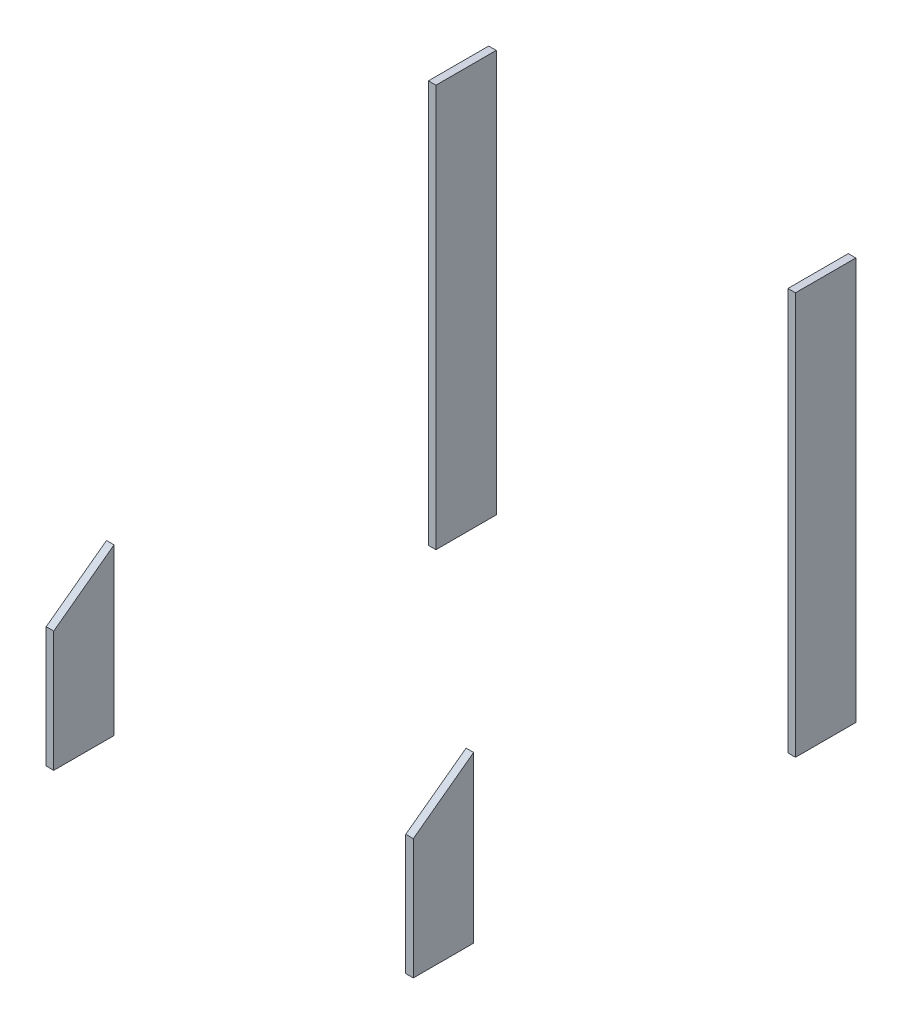
from build123d import *

# Parameters (mm, degrees)
SKETCH2_W             = 4.7625
SKETCH2_H             = 38.1
BOSS_EXTRUDE1_DEPTH   = 254
BOSS_EXTRUDE1_2_DEPTH = 254
BOSS_EXTRUDE1_3_DEPTH = 254
BOSS_EXTRUDE1_4_DEPTH = 254
CUT_EXTRUDE3_DEPTH    = 444.057570328


with BuildPart() as part:
    # Sketch2 → Boss-Extrude1 (new body)
    with BuildSketch(Plane(origin=(0, 0, 0), x_dir=(1, 0, 0), z_dir=(0, 1, 0))):
        with Locations((2.38125, -19.05)):
            Rectangle(SKETCH2_W, SKETCH2_H)
    extrude(amount=BOSS_EXTRUDE1_DEPTH)


with BuildPart() as body_2:
    # Sketch2 → Boss-Extrude1 2 (new body)
    with BuildSketch(Plane(origin=(0, 0, 0), x_dir=(1, 0, 0), z_dir=(0, 1, 0))):
        with Locations((229.39375, -19.05)):
            Rectangle(SKETCH2_W, SKETCH2_H)
    extrude(amount=BOSS_EXTRUDE1_2_DEPTH)


with BuildPart() as body_3:
    # Sketch2 → Boss-Extrude1 3 (new body)
    with BuildSketch(Plane(origin=(0, 0, 0), x_dir=(1, 0, 0), z_dir=(0, 1, 0))):
        with Locations((2.38125, -260.35)):
            Rectangle(SKETCH2_W, SKETCH2_H)
    extrude(amount=BOSS_EXTRUDE1_3_DEPTH)


with BuildPart() as body_4:
    # Sketch2 → Boss-Extrude1 4 (new body)
    with BuildSketch(Plane(origin=(0, 0, 0), x_dir=(1, 0, 0), z_dir=(0, 1, 0))):
        with Locations((229.39375, -260.35)):
            Rectangle(SKETCH2_W, SKETCH2_H)
    extrude(amount=BOSS_EXTRUDE1_4_DEPTH)


with BuildPart() as cut_extrude3_tool:
    # Sketch3 → Cut-Extrude3 (new, through all)
    with BuildSketch(Plane(origin=(0, 0, 0), x_dir=(0, 0, -1), z_dir=(1, 0, 0))):
        Polygon((-279.4, 76.2), (-279.4, 254), (-38.1, 254), align=None)
    extrude(amount=CUT_EXTRUDE3_DEPTH)


with BuildPart() as body_3_1:
    add(body_3.part)

    # Cut-Extrude3: cut by cut_extrude3_tool
    add(cut_extrude3_tool.part, mode=Mode.SUBTRACT)


with BuildPart() as body_4_1:
    add(body_4.part)

    # Cut-Extrude3: cut by cut_extrude3_tool
    add(cut_extrude3_tool.part, mode=Mode.SUBTRACT)


solid = Compound([part.part, body_2.part, body_3_1.part, body_4_1.part])
